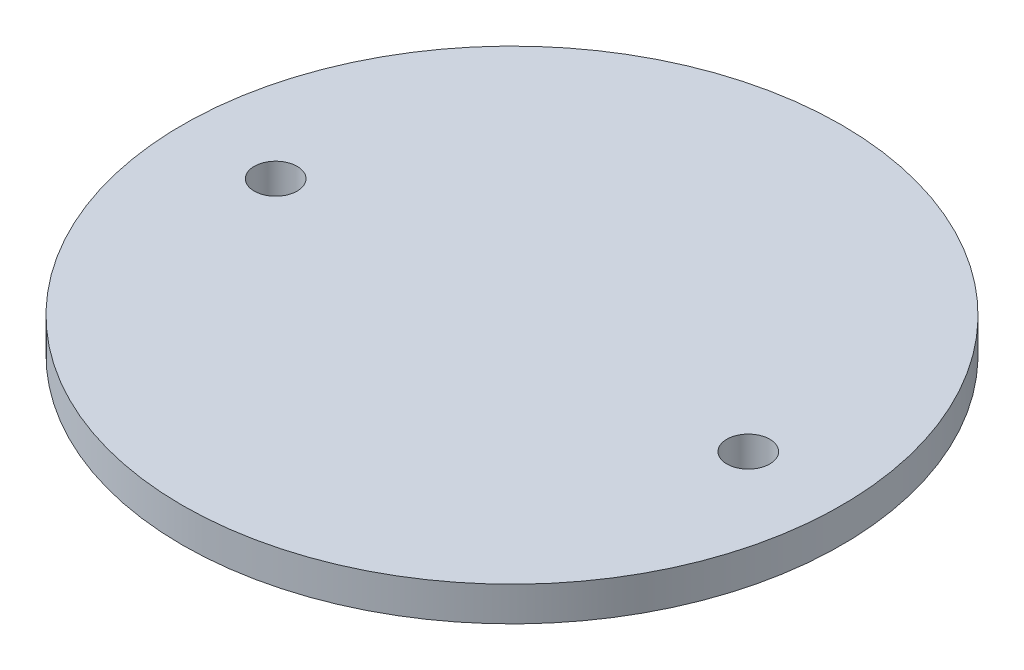
from build123d import *

# Parameters (mm, degrees)
SKETCH1_R           = 38.35
SKETCH1_R_2         = 2.5
BOSS_EXTRUDE1_DEPTH = 4


with BuildPart() as part:
    # Sketch1 → Boss-Extrude1 (new body)
    with BuildSketch(Plane(origin=(0, 0, 0), x_dir=(1, 0, 0), z_dir=(0, 1, 0))):
        with Locations(Location((0, 0, 0), (0, 0, 270))):
            Circle(SKETCH1_R)
        with Locations(Location((-27.5, 0, 0), (0, 0, 270))):
            Circle(SKETCH1_R_2, mode=Mode.SUBTRACT)
        with Locations(Location((27.5, 0, 0), (0, 0, 270))):
            Circle(SKETCH1_R_2, mode=Mode.SUBTRACT)
    extrude(amount=BOSS_EXTRUDE1_DEPTH)


solid = part.part
